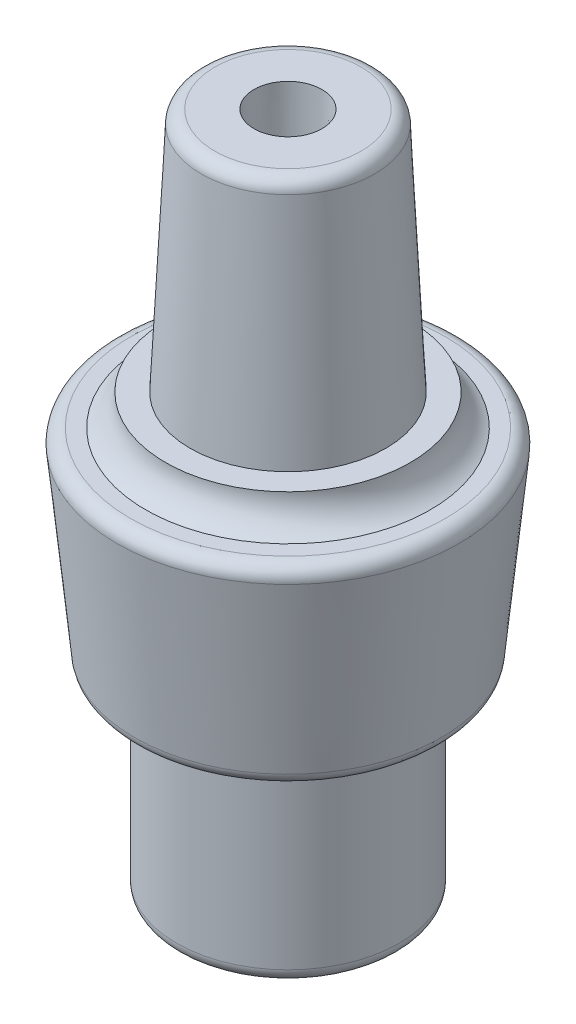
from build123d import *

# Parameters (mm, degrees)
FILLET1_R = 0.2
FILLET2_R = 0.2
FILLET3_R = 0.2


with BuildPart() as part:
    # Sketch2 → Revolve1 (revolve)
    with BuildSketch(Plane.XY, mode=Mode.PRIVATE) as revolve1_sk:
        with BuildLine():
            Line((-0.4, -4.75), (-1.638095238, -4.75))
            Line((-1.638095238, -4.75), (-1.638095238, -1.805191747))
            Line((-1.638095238, -1.805191747), (-2.235540304, -1.805191747))
            Line((-2.235540304, -1.805191747), (-2.535540304, 1.194808253))
            Line((-2.535540304, 1.194808253), (-2.093117248, 1.194808253))
            ThreePointArc((-2.093117248, 1.194808253), (-1.879618402, 1.379298482), (-1.8, 1.65))
            Line((-1.8, 1.65), (-1.438630681, 1.65))
            Line((-1.438630681, 1.65), (-1.264172597, 5.25))
            Line((-1.264172597, 5.25), (-0.5, 5.25))
            Line((-0.5, 5.25), (-0.4, 1.65))
            Line((-0.4, 1.65), (-0.4, 1.194808253))
            Line((-0.4, 1.194808253), (-0.4, -1.805191747))
            Line((-0.4, -1.805191747), (-0.4, -4.75))
        make_face()
    revolve(revolve1_sk.sketch.rotate(Axis((0, -5.25, 0), (0, 1, 0)), 270), axis=Axis((0, -5.25, 0), (0, 1, 0)))

    # Fillet1
    fillet1_edges = [part.edges().sort_by_distance(p)[0] for p in [
        (0, 5.25, 1.264172597),
    ]]
    fillet(fillet1_edges, radius=FILLET1_R)

    # Fillet2
    fillet2_edges = [part.edges().sort_by_distance(p)[0] for p in [
        (0, -4.75, 1.638095238),
    ]]
    fillet(fillet2_edges, radius=FILLET2_R)

    # Fillet3
    fillet3_edges = [part.edges().sort_by_distance(p)[0] for p in [
        (0, -1.805191747, 2.235540304),
        (0, 1.194808253, 2.535540304),
    ]]
    fillet(fillet3_edges, radius=FILLET3_R)


solid = part.part
